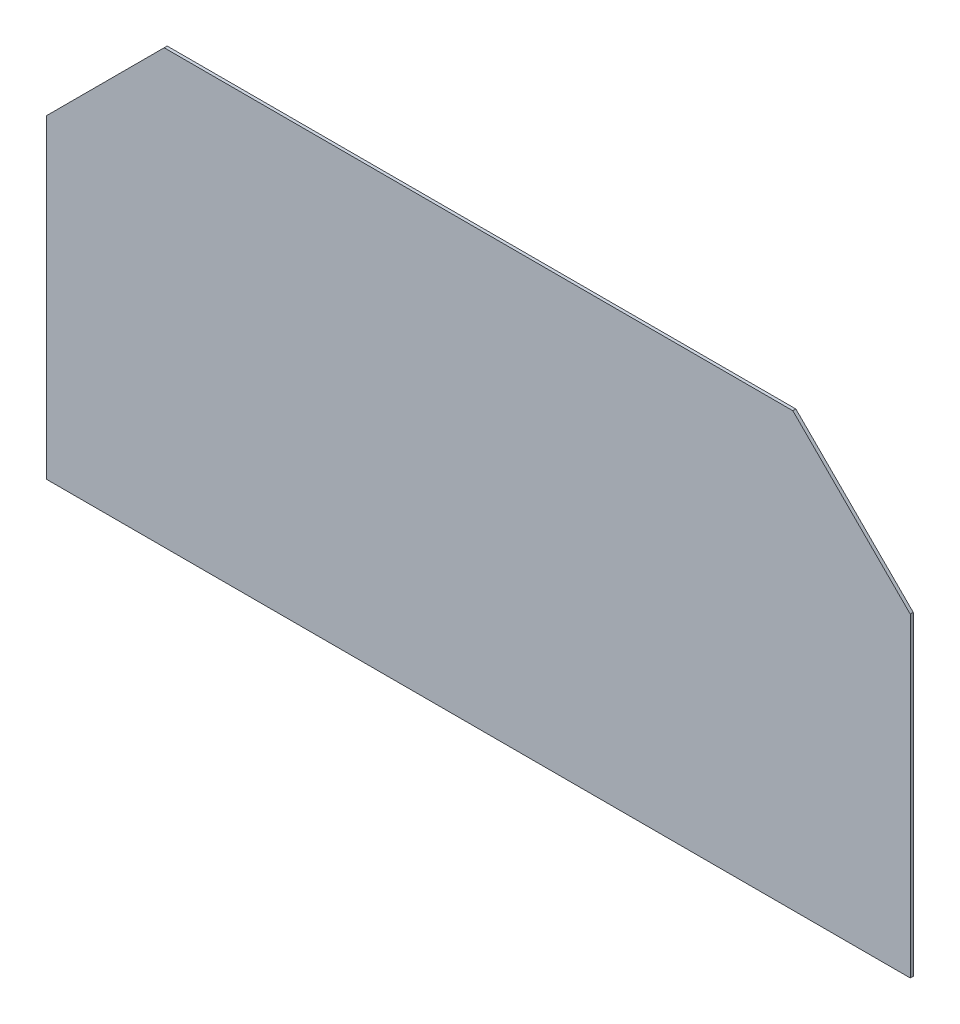
from build123d import *

# Parameters (mm, degrees)
SKETCH1_W           = 80.15
SKETCH1_H           = 40.15
BOSS_EXTRUDE2_DEPTH = 0.28
CUT_EXTRUDE1_DEPTH  = 110.28
CUT_EXTRUDE2_DEPTH  = 10


with BuildPart() as part:
    # Sketch1 → Boss-Extrude2 (new body)
    with BuildSketch(Plane.XY):
        with Locations((13.610981812, 6.34266398)):
            Rectangle(SKETCH1_W, SKETCH1_H)
    extrude(amount=BOSS_EXTRUDE2_DEPTH)

    # Sketch3 → Cut-Extrude1 (cut)
    with BuildSketch(Plane.XY.offset(0.28)):
        Polygon((53.685981812, 26.41766398), (53.685981812, 15.51766398), (42.785981812, 26.41766398), align=None)
    extrude(amount=-CUT_EXTRUDE1_DEPTH, mode=Mode.SUBTRACT)

    # Sketch6 → Cut-Extrude2 (cut)
    with BuildSketch(Plane.XY.offset(0.28)):
        Polygon((-26.464018188, 26.41766398), (-26.464018188, 15.51766398), (-15.564018188, 26.41766398), align=None)
    extrude(amount=-CUT_EXTRUDE2_DEPTH, mode=Mode.SUBTRACT)


solid = part.part
